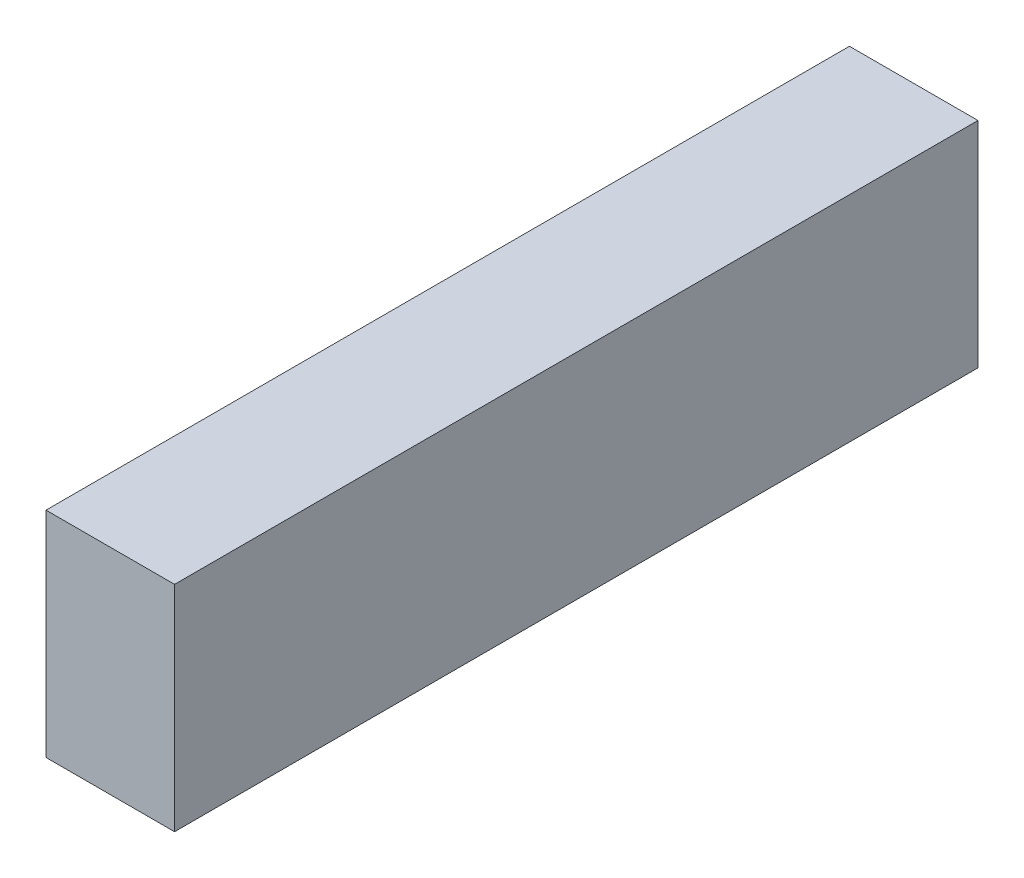
from build123d import *

# Parameters (mm, degrees)
SKETCH1_W           = 12
SKETCH1_H           = 20
BOSS_EXTRUDE1_DEPTH = 75


with BuildPart() as part:
    # Sketch1 → Boss-Extrude1 (new body)
    with BuildSketch(Plane.XY):
        Rectangle(SKETCH1_W, SKETCH1_H)
    extrude(amount=BOSS_EXTRUDE1_DEPTH)


solid = part.part
